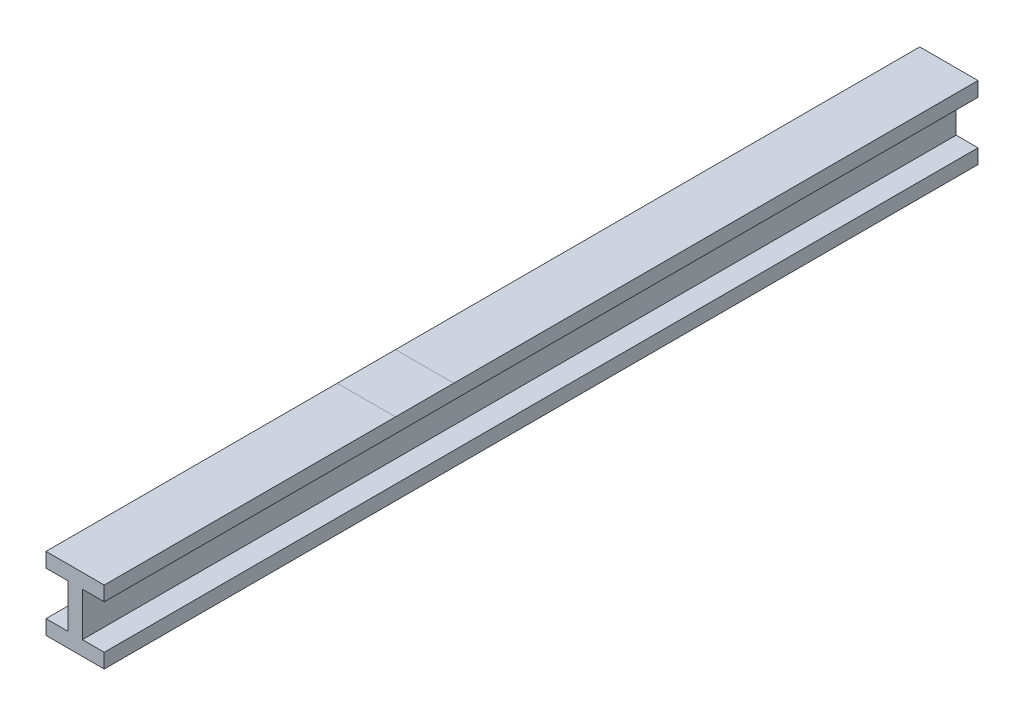
from build123d import *

# Parameters (mm, degrees)
DODANIE_WYCI_GNI_CIE1_DEPTH = 3000


with BuildPart() as part:
    # Szkic1 → Dodanie-wyciągnięcie1 (new body)
    with BuildSketch(Plane.XY):
        Polygon((0, 0), (200, 0), (200, 50), (125, 50), (125, 200), (200, 200), (200, 250), (0, 250), (0, 200), (75, 200), (75, 50), (0, 50), align=None)
    extrude(amount=-DODANIE_WYCI_GNI_CIE1_DEPTH)


solid = part.part
